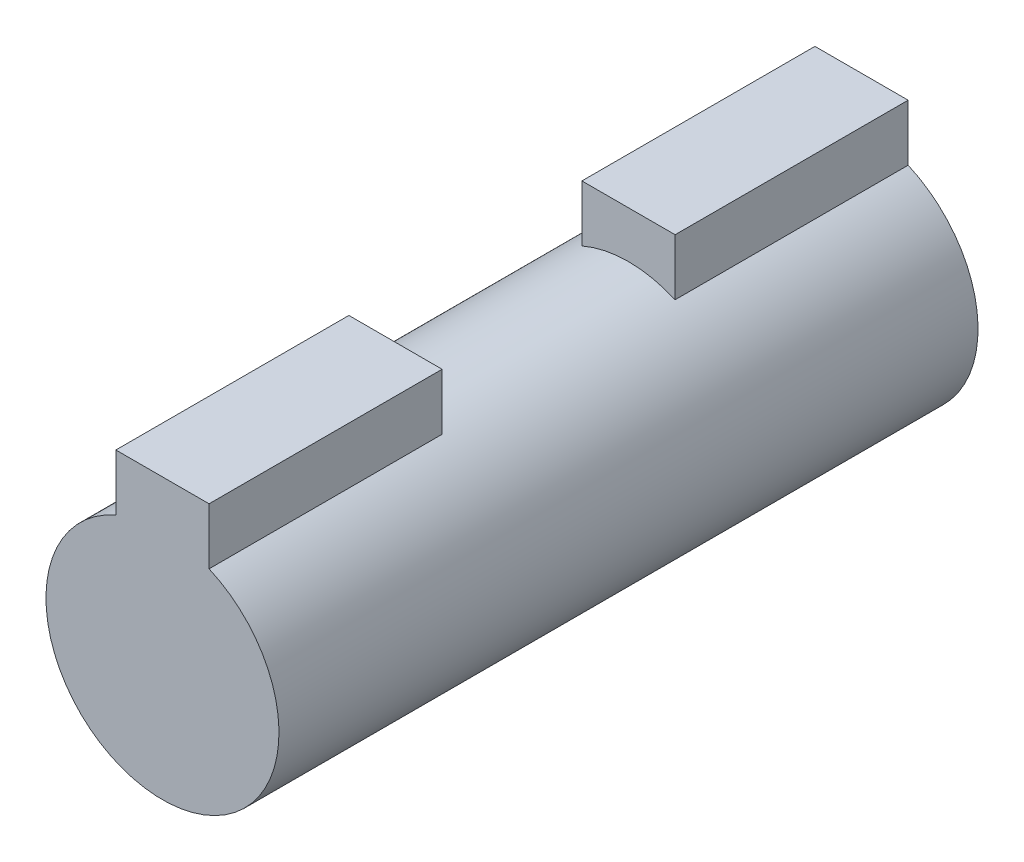
from build123d import *

# Parameters (mm, degrees)
BOSS_EXTRUDE1_DEPTH = 30
CUT_EXTRUDE1_START  = -20
SKETCH2_R           = 10
SKETCH2_R_2         = 5
CUT_EXTRUDE1_DEPTH  = 10


with BuildPart() as part:
    # Sketch1 → Boss-Extrude1 (new body)
    with BuildSketch(Plane.XY):
        with BuildLine():
            Line((2, 7), (-2, 7))
            Line((-2, 7), (-2, 4.582575695))
            ThreePointArc((-2, 4.582575695), (0, -5), (2, 4.582575695))
            Line((2, 4.582575695), (2, 7))
        make_face()
    extrude(amount=BOSS_EXTRUDE1_DEPTH)

    # Sketch2 → Cut-Extrude1 (cut)
    with BuildSketch(Plane.XY.offset(30).offset(CUT_EXTRUDE1_START)):
        Circle(SKETCH2_R)
        Circle(SKETCH2_R_2, mode=Mode.SUBTRACT)
    extrude(amount=CUT_EXTRUDE1_DEPTH, mode=Mode.SUBTRACT)


solid = part.part
